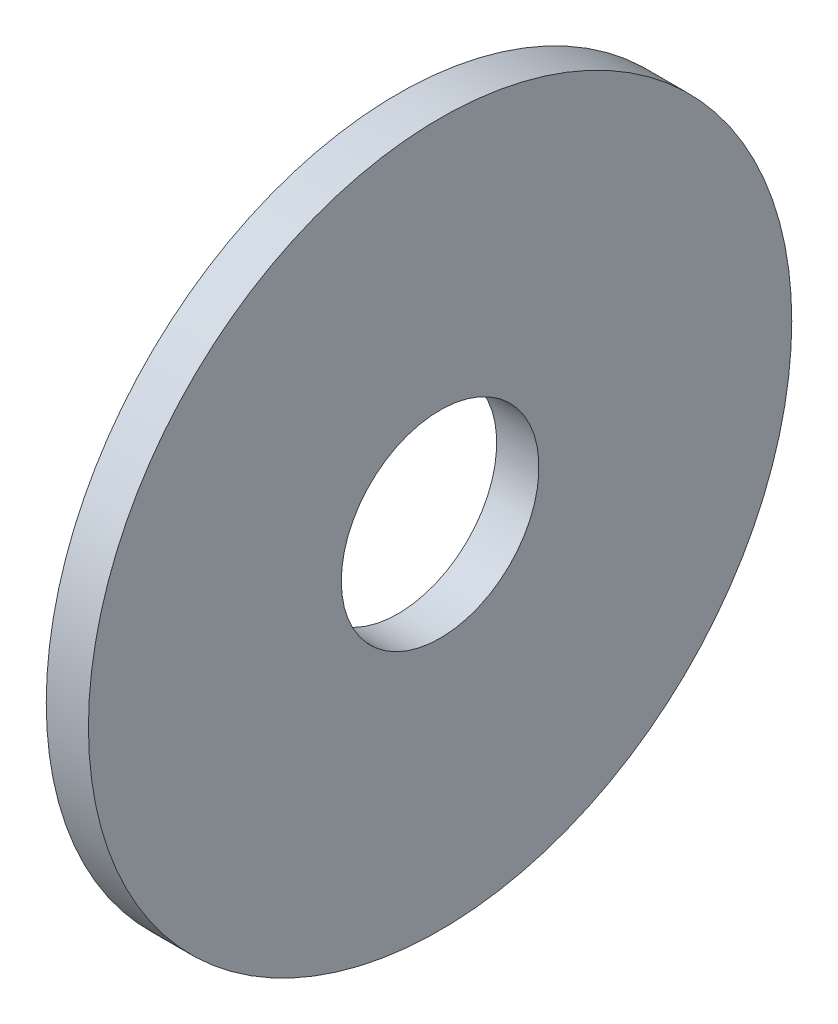
from build123d import *

# Parameters (mm, degrees)
SKETCH1_R           = 12.7
SKETCH1_R_2         = 3.5687
BOSS_EXTRUDE1_DEPTH = 1.524


with BuildPart() as part:
    # Sketch1 → Boss-Extrude1 (new body)
    with BuildSketch(Plane(origin=(0, 0, 0), x_dir=(0, 0, -1), z_dir=(1, 0, 0))):
        with Locations(Location((0, 0, 0), (0, 0, 180))):
            Circle(SKETCH1_R)
        with Locations(Location((0, 0, 0), (0, 0, 180))):
            Circle(SKETCH1_R_2, mode=Mode.SUBTRACT)
    extrude(amount=BOSS_EXTRUDE1_DEPTH)


solid = part.part
